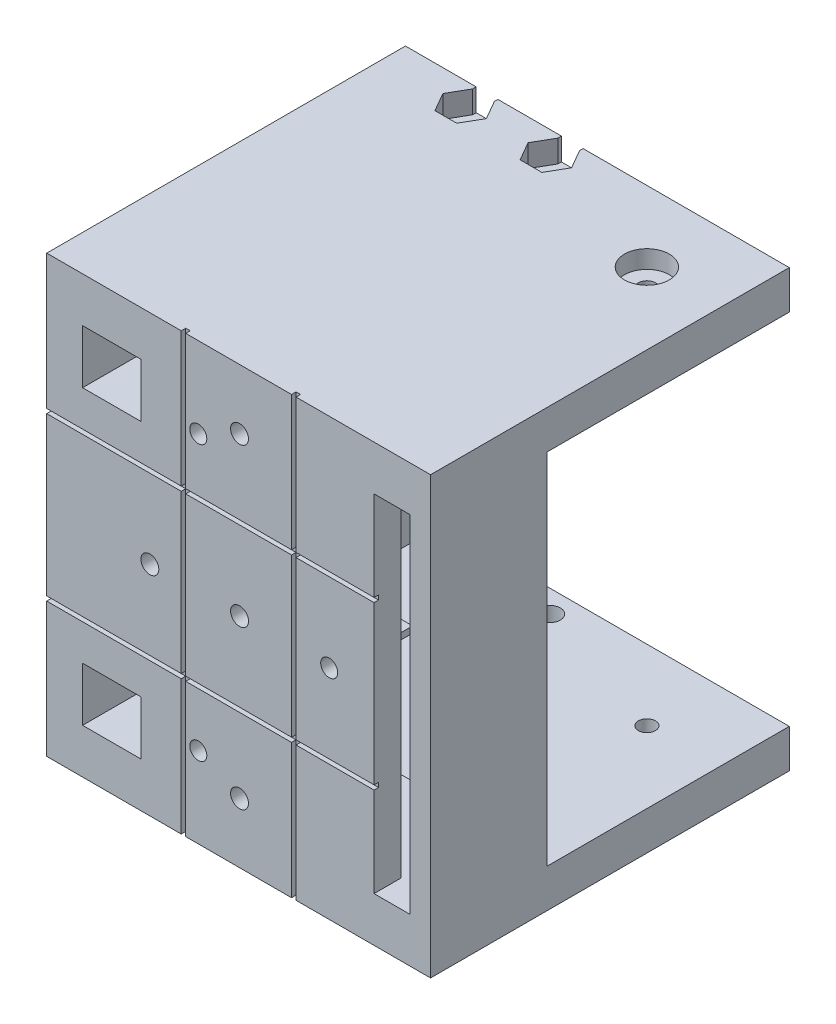
from build123d import *

# Parameters (mm, degrees)
EXTRUDE_1_DEPTH          = 20
SKETCH_2_W               = 4
SKETCH_2_H               = 38.6
CUT_EXTRUDE_1_DEPTH      = 20
CUT_EXTRUDE_2_DEPTH      = 65.286857133
CUT_EXTRUDE_2_DEPTH_BACK = 65.286857133
SKETCH_3_R               = 1.175
EXTRUDE_2_DEPTH          = 20
CUT_EXTRUDE_3_DEPTH      = 17
SKETCH_7_R               = 1
CUT_EXTRUDE_4_DEPTH      = 4.8
SKETCH_8_W               = 4
SKETCH_8_H               = 20.6
CUT_EXTRUDE_5_DEPTH      = 25.4
EXTRUDE_START            = 10
SKETCH_9_R               = 1.9
SKETCH_9_R_2             = 1
EXTRUDE_3_DEPTH          = 10
CUT_EXTRUDE_6_DEPTH      = 2.5
CUT_EXTRUDE_7_DEPTH      = 2.5
CUT_EXTRUDE_10_DEPTH     = 27
SKETCH_15_R              = 0.95
CUT_EXTRUDE_11_DEPTH     = 50
SKETCH_16_R              = 2.5
CUT_EXTRUDE_12_DEPTH     = 2
CUT_EXTRUDE_START        = -2
SKETCH_17_R              = 2.5
CUT_EXTRUDE_13_DEPTH     = 2
SKETCH_18_W              = 3
SKETCH_18_H              = 38.6
EXTRUDE_4_DEPTH          = 10
SKETCH_19_W              = 11.8
SKETCH_19_H              = 17.6
CUT_EXTRUDE_14_DEPTH     = 0.5
SKETCH_20_R              = 0.95
CUT_EXTRUDE_15_DEPTH     = 10.5
SKETCH_21_W              = 8.8
SKETCH_21_H              = 0.7
CUT_EXTRUDE_16_DEPTH     = 12
SKETCH_23_W              = 2.3
SKETCH_23_H              = 48.6
EXTRUDE_5_DEPTH          = 13
SKETCH_26_R              = 0.95
CUT_EXTRUDE_17_DEPTH     = 10
SKETCH_27_R              = 1.25
CUT_EXTRUDE_18_DEPTH     = 2


with BuildPart() as part:
    # 草图1 → 凸台-拉伸1 (new, symmetric)
    with BuildSketch(Plane.XY):
        Polygon((4, 5), (10.5, 5), (10.5, 8), (14.5, 8), (14.5, 5), (42.8, 5), (42.8, 0), (0, 0), (0, 48.6), (42.8, 48.6), (42.8, 43.6), (14.5, 43.6), (14.5, 40.6), (10.5, 40.6), (10.5, 43.6), (4, 43.6), align=None)
    extrude(amount=EXTRUDE_1_DEPTH, both=True)

    # 草图2 → 切除-拉伸1 (cut)
    with BuildSketch(Plane(origin=(0, 0, -20), x_dir=(-1, 0, 0), z_dir=(0, 0, -1))):
        with Locations((-12.5, 24.3)):
            Rectangle(SKETCH_2_W, SKETCH_2_H)
    extrude(amount=-CUT_EXTRUDE_1_DEPTH, mode=Mode.SUBTRACT)

    # 草图3 → 切除-拉伸2 (cut, two sides: drawn at the far end of the back side and taken through both)
    with BuildSketch(Plane.XZ.offset(-43.6).offset(-CUT_EXTRUDE_2_DEPTH_BACK)):
        with Locations((9.1, -17.5)):
            Circle(SKETCH_3_R)
        with Locations((18.6, -17.5)):
            Circle(SKETCH_3_R)
    extrude(amount=CUT_EXTRUDE_2_DEPTH + CUT_EXTRUDE_2_DEPTH_BACK, mode=Mode.SUBTRACT)

    # 草图4 → 凸台-拉伸2 (add)
    with BuildSketch(Plane.XY.offset(20)):
        Polygon((10.5, 40.6), (10.5, 37.6), (4, 37.6), (4, 11), (10.5, 11), (10.5, 8), (14.5, 8), (14.5, 5), (26.5, 5), (26.5, 43.6), (14.5, 43.6), (14.5, 40.6), align=None)
    extrude(amount=-EXTRUDE_2_DEPTH)

    # 草图6 → 切除-拉伸3 (cut)
    with BuildSketch(Plane(origin=(0, 0, 0), x_dir=(-1, 0, 0), z_dir=(0, 0, -1))):
        Polygon((-26.5, 43.6), (-13.5, 43.6), (-13.5, 34.6), (-4, 34.6), (-4, 14), (-13.5, 14), (-13.5, 5), (-26.5, 5), align=None)
    extrude(amount=-CUT_EXTRUDE_3_DEPTH, mode=Mode.SUBTRACT)

    # 草图7 → 切除-拉伸4 (cut)
    with BuildSketch(Plane(origin=(0, 0, 17), x_dir=(-1, 0, 0), z_dir=(0, 0, -1))):
        with Locations((-21.5, 24.3)):
            Circle(SKETCH_7_R)
        with Locations((-11.5, 24.3)):
            Circle(SKETCH_7_R)
        with Locations((-21.5, 6.7)):
            Circle(SKETCH_7_R)
        with Locations((-21.5, 41.9)):
            Circle(SKETCH_7_R)
    extrude(amount=-CUT_EXTRUDE_4_DEPTH, mode=Mode.SUBTRACT)

    # 草图8 → 切除-拉伸5 (cut)
    with BuildSketch(Plane(origin=(0, 0, -20), x_dir=(-1, 0, 0), z_dir=(0, 0, -1))):
        with Locations((-2, 24.3)):
            Rectangle(SKETCH_8_W, SKETCH_8_H)
    extrude(amount=-CUT_EXTRUDE_5_DEPTH, mode=Mode.SUBTRACT)

    # 草图9 → 凸台-拉伸3 (add)
    # profile 1 of 3: a face of its own
    with BuildSketch(Plane(origin=(0, 0, 17), x_dir=(-1, 0, 0), z_dir=(0, 0, -1)).offset(EXTRUDE_START)):
        with Locations((-21.5, 41.9)):
            Circle(SKETCH_9_R)
        with Locations((-21.5, 41.9)):
            Circle(SKETCH_9_R_2, mode=Mode.SUBTRACT)
    # profile 2 of 3: a face of its own
    with BuildSketch(Plane(origin=(0, 0, 17), x_dir=(-1, 0, 0), z_dir=(0, 0, -1)).offset(EXTRUDE_START)):
        with Locations(Location((-11.5, 24.3, 0), (0, 0, 180))):
            Circle(SKETCH_9_R)
        with Locations((-11.5, 24.3)):
            Circle(SKETCH_9_R_2, mode=Mode.SUBTRACT)
    # profile 3 of 3: a face of its own
    with BuildSketch(Plane(origin=(0, 0, 17), x_dir=(-1, 0, 0), z_dir=(0, 0, -1)).offset(EXTRUDE_START)):
        with Locations((-21.5, 6.7)):
            Circle(SKETCH_9_R)
        with Locations((-21.5, 6.7)):
            Circle(SKETCH_9_R_2, mode=Mode.SUBTRACT)
    extrude(amount=-EXTRUDE_3_DEPTH)

    # 草图10 → 切除-拉伸6 (cut)
    with BuildSketch(Plane(origin=(0, 48.6, 0), x_dir=(1, 0, 0), z_dir=(0, 1, 0))):
        Polygon((11.524871131, 17.5), (10.312435565, 19.6), (10.312435565, 20), (7.887564435, 20), (7.887564435, 19.6), (6.675128869, 17.5), (7.887564435, 15.4), (10.312435565, 15.4), align=None)
        Polygon((21.024871131, 17.5), (19.812435565, 19.6), (19.812435565, 20), (17.387564435, 20), (17.387564435, 19.6), (16.175128869, 17.5), (17.387564435, 15.4), (19.812435565, 15.4), align=None)
    extrude(amount=-CUT_EXTRUDE_6_DEPTH, mode=Mode.SUBTRACT)

    # 草图11 → 切除-拉伸7 (cut)
    with BuildSketch(Plane.XZ):
        Polygon((11.524871131, -17.5), (10.312435565, -15.4), (7.887564435, -15.4), (6.675128869, -17.5), (7.887564435, -19.6), (7.887564435, -20), (10.312435565, -20), (10.312435565, -19.6), align=None)
        Polygon((21.024871131, -17.5), (19.812435565, -15.4), (17.387564435, -15.4), (16.175128869, -17.5), (17.387564435, -19.6), (17.387564435, -20), (19.812435565, -20), (19.812435565, -19.6), align=None)
    extrude(amount=-CUT_EXTRUDE_7_DEPTH, mode=Mode.SUBTRACT)

    # 草图14 → 切除-拉伸10 (cut)
    with BuildSketch(Plane(origin=(0, 0, -20), x_dir=(-1, 0, 0), z_dir=(0, 0, -1))):
        Polygon((-42.8, 4.3), (-12.8, 4.3), (-12.8, 13.3), (-4, 13.3), (-4, 14), (-13.5, 14), (-13.5, 5), (-42.8, 5), align=None)
        Polygon((-4, 35.3), (-12.8, 35.3), (-12.8, 44.3), (-42.8, 44.3), (-42.8, 43.6), (-13.5, 43.6), (-13.5, 34.6), (-4, 34.6), align=None)
    extrude(amount=-CUT_EXTRUDE_10_DEPTH, mode=Mode.SUBTRACT)

    # 草图15 → 切除-拉伸11 (cut)
    with BuildSketch(Plane.XZ):
        with Locations((34.8, -12.122060158)):
            Circle(SKETCH_15_R)
    extrude(amount=-CUT_EXTRUDE_11_DEPTH, mode=Mode.SUBTRACT)

    # 草图16 → 切除-拉伸12 (cut)
    with BuildSketch(Plane.XZ):
        with Locations((34.8, -12.122060158)):
            Circle(SKETCH_16_R)
    extrude(amount=-CUT_EXTRUDE_12_DEPTH, mode=Mode.SUBTRACT)

    # 草图17 → 切除-拉伸13 (cut)
    with BuildSketch(Plane(origin=(0, 48.6, 0), x_dir=(1, 0, 0), z_dir=(0, 1, 0)).offset(CUT_EXTRUDE_START)):
        with Locations((34.8, 12.122060158)):
            Circle(SKETCH_17_R)
    extrude(amount=CUT_EXTRUDE_13_DEPTH, mode=Mode.SUBTRACT)

    # 草图18 → 凸台-拉伸4 (add)
    with BuildSketch(Plane(origin=(26.5, 0, 0), x_dir=(0, 0, -1), z_dir=(1, 0, 0))):
        with Locations((-18.5, 24.3)):
            Rectangle(SKETCH_18_W, SKETCH_18_H)
    extrude(amount=EXTRUDE_4_DEPTH)

    # 草图19 → 切除-拉伸14 (cut)
    with BuildSketch(Plane.XY.offset(20)):
        Polygon((15, 48.6), (15.5, 48.6), (15.5, 33.6), (27.3, 33.6), (27.3, 48.6), (27.8, 48.6), (27.8, 33.6), (36.5, 33.6), (36.5, 33.1), (27.8, 33.1), (27.8, 15.5), (36.5, 15.5), (36.5, 15), (27.8, 15), (27.8, 0), (27.3, 0), (27.3, 15), (15.5, 15), (15.5, 0), (15, 0), (15, 15), (0, 15), (0, 15.5), (15, 15.5), (15, 33.1), (0, 33.1), (0, 33.6), (15, 33.6), align=None)
        with Locations((21.4, 24.3)):
            Rectangle(SKETCH_19_W, SKETCH_19_H, mode=Mode.SUBTRACT)
    extrude(amount=-CUT_EXTRUDE_14_DEPTH, mode=Mode.SUBTRACT)

    # 草图20 → 切除-拉伸15 (cut)
    with BuildSketch(Plane(origin=(0, 0, 17), x_dir=(-1, 0, 0), z_dir=(0, 0, -1))):
        with Locations((-31.5, 24.3)):
            Circle(SKETCH_20_R)
    extrude(amount=-CUT_EXTRUDE_15_DEPTH, mode=Mode.SUBTRACT)

    # 草图21 → 切除-拉伸16 (cut)
    with BuildSketch(Plane(origin=(0, 0, -20), x_dir=(-1, 0, 0), z_dir=(0, 0, -1))):
        with Locations((-8.4, 43.95)):
            Rectangle(SKETCH_21_W, SKETCH_21_H)
        with Locations((-8.4, 4.65)):
            Rectangle(SKETCH_21_W, SKETCH_21_H)
    extrude(amount=-CUT_EXTRUDE_16_DEPTH, mode=Mode.SUBTRACT)

    # 草图23 → 凸台-拉伸5 (add)
    with BuildSketch(Plane.XY.offset(20)):
        with Locations((41.65, 24.3)):
            Rectangle(SKETCH_23_W, SKETCH_23_H)
    extrude(amount=-EXTRUDE_5_DEPTH)

    # 草图26 → 切除-拉伸17 (cut)
    with BuildSketch(Plane.XY.offset(20)):
        with Locations((16.9, 9)):
            Circle(SKETCH_26_R)
        with Locations((16.9, 39.6)):
            Circle(SKETCH_26_R)
    extrude(amount=-CUT_EXTRUDE_17_DEPTH, mode=Mode.SUBTRACT)

    # 草图27 → 切除-拉伸18 (cut)
    with BuildSketch(Plane(origin=(0, 0, 7), x_dir=(-1, 0, 0), z_dir=(0, 0, -1))):
        with Locations((-21.5, 41.9)):
            Circle(SKETCH_27_R)
        with Locations((-11.5, 24.3)):
            Circle(SKETCH_27_R)
        with Locations((-21.5, 6.7)):
            Circle(SKETCH_27_R)
    extrude(amount=-CUT_EXTRUDE_18_DEPTH, mode=Mode.SUBTRACT)


solid = part.part
